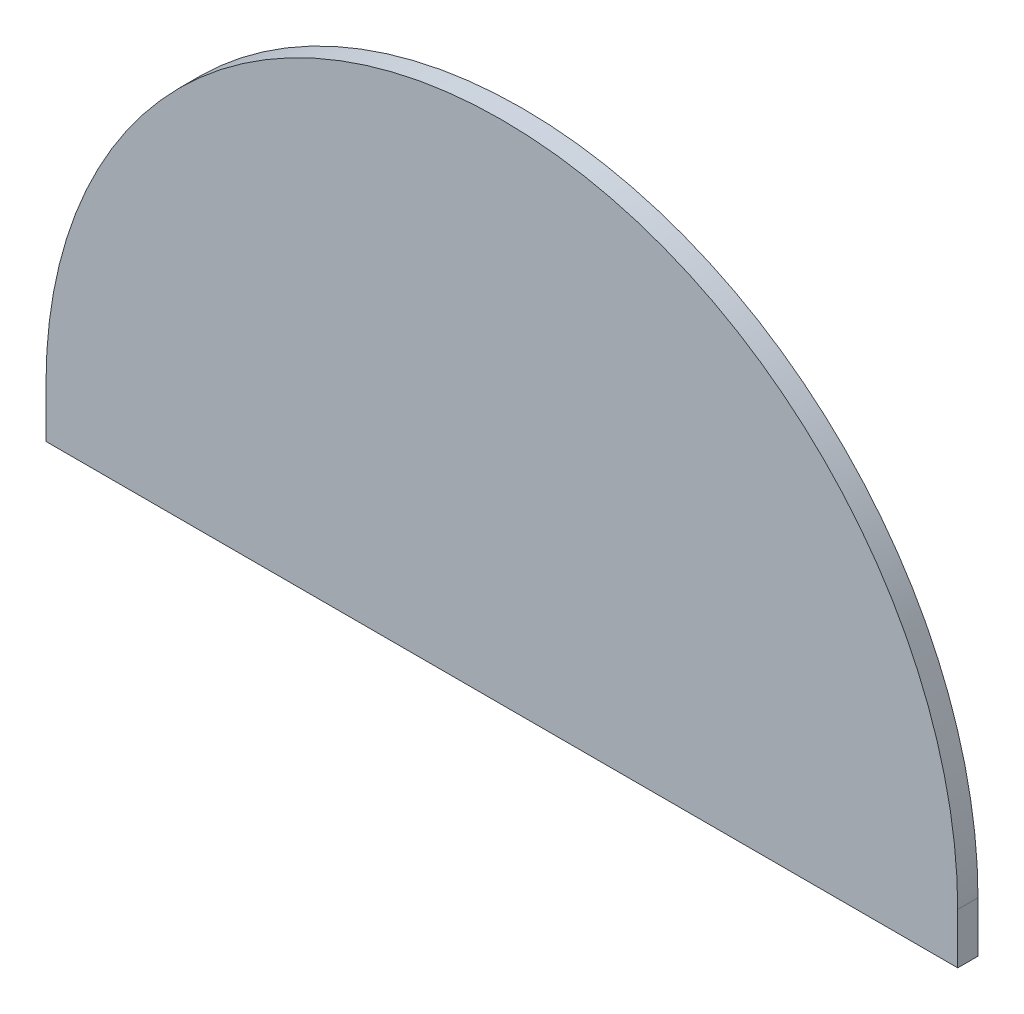
from build123d import *

# Parameters (mm, degrees)
BOSS_EXTRUDE1_DEPTH = 2
SKETCH2_W           = 90
SKETCH2_H           = 2
BOSS_EXTRUDE2_DEPTH = 5


with BuildPart() as part:
    # Sketch1 → Boss-Extrude1 (new body)
    with BuildSketch(Plane.XY):
        with BuildLine():
            Line((-45, 0), (45, 0))
            ThreePointArc((45, 0), (0, 45), (-45, 0))
        make_face()
    extrude(amount=BOSS_EXTRUDE1_DEPTH)

    # Sketch2 → Boss-Extrude2 (add)
    with BuildSketch(Plane.XZ):
        with Locations((0, 1)):
            Rectangle(SKETCH2_W, SKETCH2_H)
    extrude(amount=BOSS_EXTRUDE2_DEPTH)


solid = part.part
